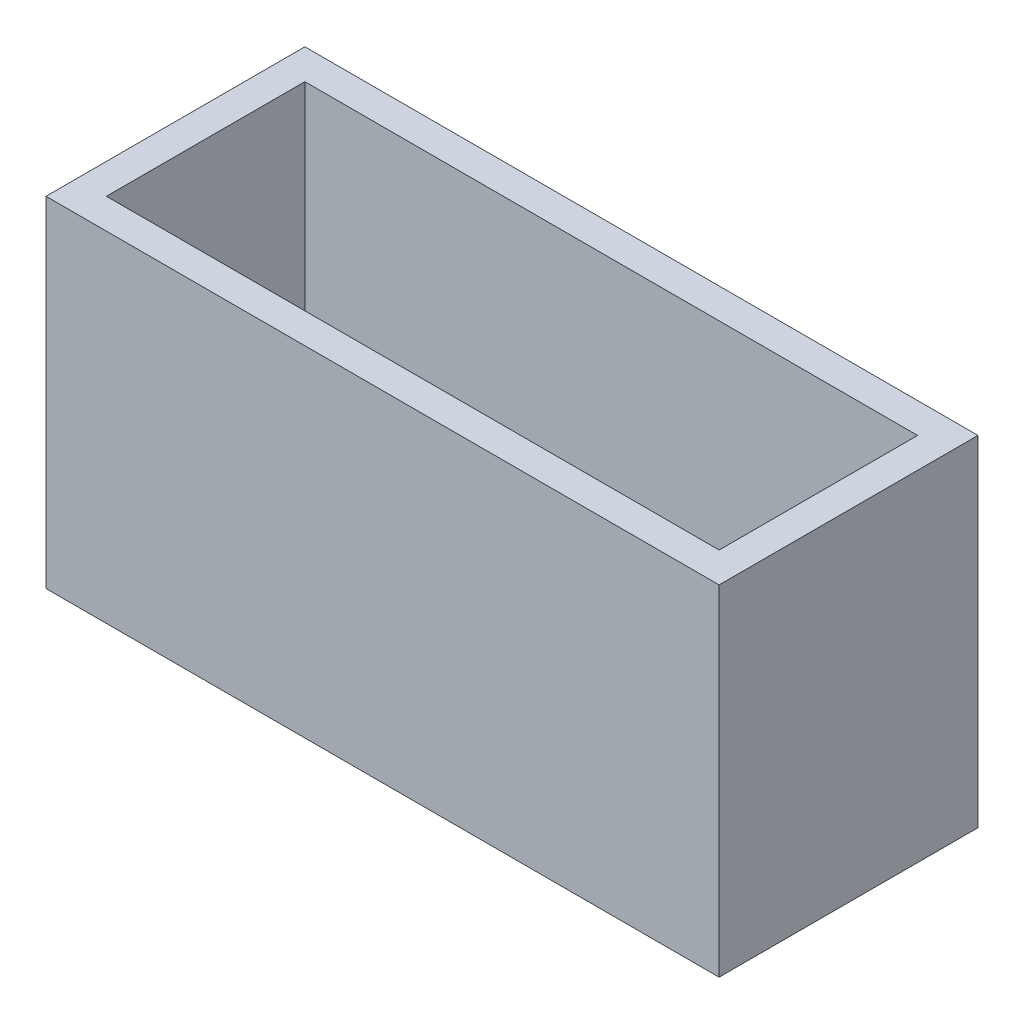
from build123d import *

# Parameters (mm, degrees)
SKETCH1_W           = 1981.2
SKETCH1_H           = 762
SKETCH1_W_2         = 1803.4
SKETCH1_H_2         = 584.2
BOSS_EXTRUDE1_DEPTH = 1000


with BuildPart() as part:
    # Sketch1 → Boss-Extrude1 (new body)
    with BuildSketch(Plane(origin=(0, 0, 0), x_dir=(1, 0, 0), z_dir=(0, 1, 0))):
        Rectangle(SKETCH1_W, SKETCH1_H)
        Rectangle(SKETCH1_W_2, SKETCH1_H_2, mode=Mode.SUBTRACT)
    extrude(amount=BOSS_EXTRUDE1_DEPTH)


solid = part.part
